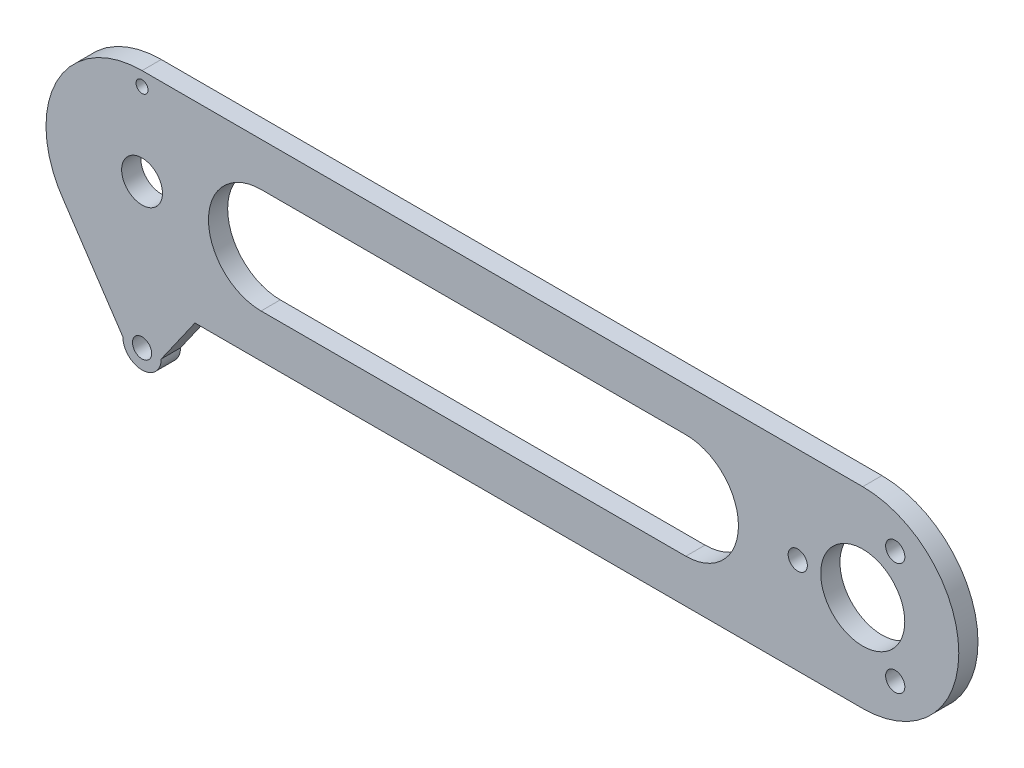
from build123d import *

# Parameters (mm, degrees)
SKETCH_1_R      = 4.25
SKETCH_1_R_2    = 8.75
SKETCH_1_R_3    = 2
SKETCH_1_R_4    = 1.25
EXTRUDE_1_DEPTH = 4


with BuildPart() as part:
    # 草图1 → 凸台-拉伸1 (new body)
    with BuildSketch(Plane.XY):
        with BuildLine():
            Line((-5, -30), (-17.208156126, -11.717323713))
            ThreePointArc((-17.208156126, -11.717323713), (-18.809358134, 9.10092099), (-1, 20))
            Line((-1, 20), (149.064295006, 20))
            ThreePointArc((149.064295006, 20), (169.064295006, 0), (149.064295006, -20))
            Line((149.064295006, -20), (10.014533743, -20))
            Line((10.014533743, -20), (3, -30))
            ThreePointArc((3, -30), (-1, -34), (-5, -30))
        make_face()
        with Locations((-1, 0)):
            Circle(SKETCH_1_R, mode=Mode.SUBTRACT)
        with Locations((149.064295006, 0)):
            Circle(SKETCH_1_R_2, mode=Mode.SUBTRACT)
        with Locations((135.534295006, 0)):
            Circle(SKETCH_1_R_3, mode=Mode.SUBTRACT)
        with Locations((155.829295006, 11.717323713)):
            Circle(SKETCH_1_R_3, mode=Mode.SUBTRACT)
        with Locations((155.829295006, -11.717323713)):
            Circle(SKETCH_1_R_3, mode=Mode.SUBTRACT)
        with Locations((-1, -30)):
            Circle(SKETCH_1_R_3, mode=Mode.SUBTRACT)
        with Locations((-1, 17.12)):
            Circle(SKETCH_1_R_4, mode=Mode.SUBTRACT)
        with BuildLine():
            Line((23.78352134, 10.95385289), (112.230567298, 10.95385289))
            ThreePointArc((112.230567298, 10.95385289), (123.184420188, 0), (112.230567298, -10.95385289))
            Line((112.230567298, -10.95385289), (23.78352134, -10.95385289))
            ThreePointArc((23.78352134, -10.95385289), (12.829668451, 0), (23.78352134, 10.95385289))
        make_face(mode=Mode.SUBTRACT)
    extrude(amount=EXTRUDE_1_DEPTH)


solid = part.part
